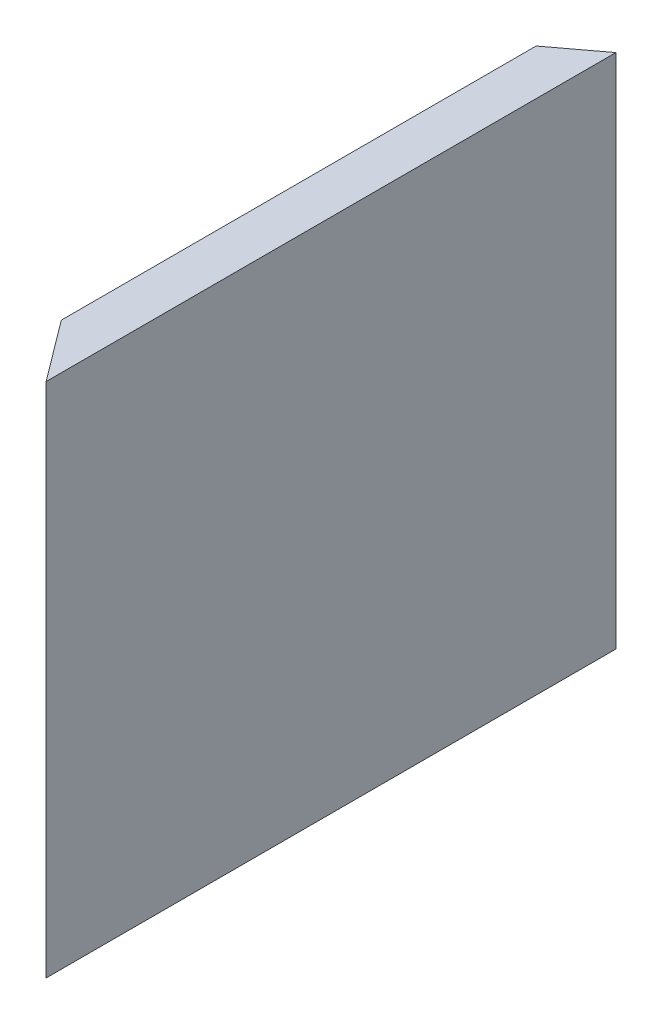
from build123d import *

# Parameters (mm, degrees)
SKETCH1_W           = 75
SKETCH1_H           = 68
BOSS_EXTRUDE1_DEPTH = 6
CUT_EXTRUDE1_DEPTH  = 78.886134838
CUT_EXTRUDE2_DEPTH  = 78.886134838


with BuildPart() as part:
    # Sketch1 → Boss-Extrude1 (new body)
    with BuildSketch(Plane(origin=(0, 0, 0), x_dir=(0, 0, -1), z_dir=(1, 0, 0))):
        Rectangle(SKETCH1_W, SKETCH1_H)
    extrude(amount=BOSS_EXTRUDE1_DEPTH)

    # Sketch2 → Cut-Extrude1 (cut, through all)
    with BuildSketch(Plane(origin=(0, 34, 0), x_dir=(1, 0, 0), z_dir=(0, 1, 0))):
        Polygon((6, 37.5), (0, 33), (0, 37.5), align=None)
    extrude(amount=-CUT_EXTRUDE1_DEPTH, mode=Mode.SUBTRACT)

    # Sketch3 → Cut-Extrude2 (cut, through all)
    with BuildSketch(Plane(origin=(0, 34, 0), x_dir=(1, 0, 0), z_dir=(0, 1, 0))):
        Polygon((6, -37.5), (0, -29.5), (0, -37.5), align=None)
    extrude(amount=-CUT_EXTRUDE2_DEPTH, mode=Mode.SUBTRACT)


solid = part.part
